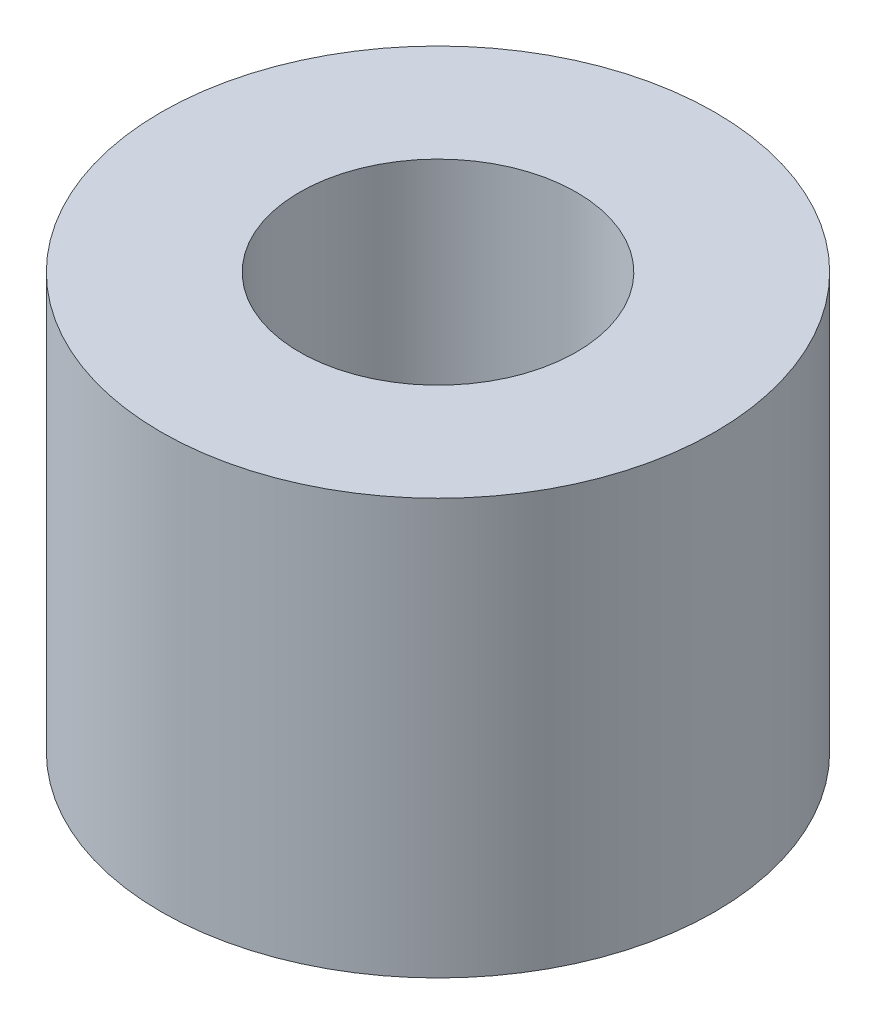
from build123d import *

# Parameters (mm, degrees)
SKETCH2_R           = 6.35
SKETCH2_R_2         = 3.175
BOSS_EXTRUDE1_DEPTH = 9.525


with BuildPart() as part:
    # Sketch2 → Boss-Extrude1 (new body)
    with BuildSketch(Plane(origin=(0, 0, 0), x_dir=(1, 0, 0), z_dir=(0, 1, 0))):
        with Locations(Location((0, 0, 0), (0, 0, 90))):
            Circle(SKETCH2_R)
        with Locations(Location((0, 0, 0), (0, 0, 90))):
            Circle(SKETCH2_R_2, mode=Mode.SUBTRACT)
    extrude(amount=BOSS_EXTRUDE1_DEPTH)


solid = part.part
